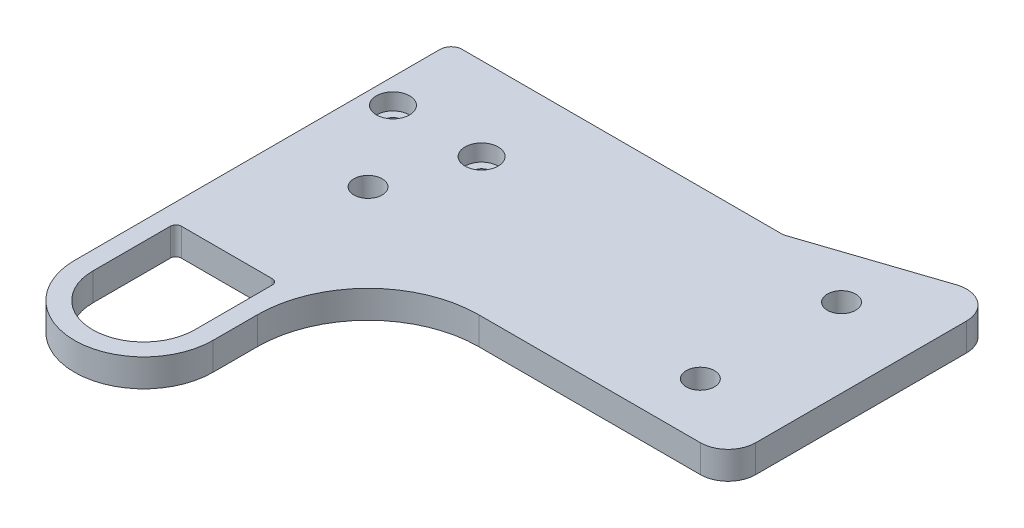
from build123d import *

# Parameters (mm, degrees)
SKETCH_1_R          = 2.55
SKETCH_1_R_2        = 7.5
EXTRUDE_1_DEPTH     = 5
FILLET_1_R          = 20
FILLET_2_R          = 5
CUT_EXTRUDE_1_DEPTH = 109.559891304
EXTRUDE_2_DEPTH     = 5
SKETCH_3_R          = 1.55
CUT_EXTRUDE_2_DEPTH = 109.559891304
FILLET_3_R          = 2
SKETCH_5_R          = 3
CUT_EXTRUDE_3_DEPTH = 3


with BuildPart() as part:
    # ｽｹｯﾁ1 → ﾎﾞｽ - 押し出し1 (new body)
    with BuildSketch(Plane(origin=(0, 0, 0), x_dir=(1, 0, 0), z_dir=(0, 1, 0))):
        with BuildLine():
            Line((0, 0), (0, -48))
            ThreePointArc((0, -48), (12.5, -60.5), (25, -48))
            Line((25, -48), (25, -20))
            Line((25, -20), (90, -20))
            Line((90, -20), (90, 30))
            Line((90, 30), (0, 0))
        make_face()
        with Locations(Location((75.769750529, 14.715657976, 0), (0, 0, 270))):
            Circle(SKETCH_1_R, mode=Mode.SUBTRACT)
        with Locations(Location((75, -10, 0), (0, 0, 270))):
            Circle(SKETCH_1_R, mode=Mode.SUBTRACT)
        with Locations(Location((15, -10, 0), (0, 0, 270))):
            Circle(SKETCH_1_R, mode=Mode.SUBTRACT)
        with Locations(Location((12.5, -48, 0), (0, 0, 270))):
            Circle(SKETCH_1_R_2, mode=Mode.SUBTRACT)
    extrude(amount=EXTRUDE_1_DEPTH)

    # ﾌｨﾚｯﾄ1
    fillet_1_edges = [part.edges().sort_by_distance(p)[0] for p in [
        (25, 2.5, 20),
    ]]
    fillet(fillet_1_edges, radius=FILLET_1_R)

    # ﾌｨﾚｯﾄ2
    fillet_2_edges = [part.edges().sort_by_distance(p)[0] for p in [
        (90, 2.5, -30),
        (90, 2.5, 20),
    ]]
    fillet(fillet_2_edges, radius=FILLET_2_R)

    # ｽｹｯﾁ2 → ｶｯﾄ - 押し出し1 (cut, through all)
    with BuildSketch(Plane(origin=(0, 5, 0), x_dir=(1, 0, 0), z_dir=(0, 1, 0))):
        with BuildLine():
            Line((3.3, -48), (3.3, -34))
            ThreePointArc((3.3, -34), (3.592893219, -33.292893219), (4.3, -33))
            Line((4.3, -33), (20.7, -33))
            ThreePointArc((20.7, -33), (21.407106781, -33.292893219), (21.7, -34))
            Line((21.7, -34), (21.7, -48))
            ThreePointArc((21.7, -48), (12.5, -57.2), (3.3, -48))
        make_face()
    extrude(amount=-CUT_EXTRUDE_1_DEPTH, mode=Mode.SUBTRACT)

    # ｽｹｯﾁ4 → ﾎﾞｽ - 押し出し2 (add)
    with BuildSketch(Plane(origin=(0, 5, 0), x_dir=(1, 0, 0), z_dir=(0, 1, 0))):
        Polygon((0, 0), (0, 20), (60, 20), align=None)
    extrude(amount=-EXTRUDE_2_DEPTH)

    # ｽｹｯﾁ3 → ｶｯﾄ - 押し出し2 (cut, through all)
    with BuildSketch(Plane(origin=(0, 5, 0), x_dir=(1, 0, 0), z_dir=(0, 1, 0))):
        with Locations(Location((20.5, 5, 0), (0, 0, 270))):
            Circle(SKETCH_3_R)
        with Locations(Location((4.5, 5, 0), (0, 0, 90))):
            Circle(SKETCH_3_R)
    extrude(amount=-CUT_EXTRUDE_2_DEPTH, mode=Mode.SUBTRACT)

    # ﾌｨﾚｯﾄ3
    fillet_3_edges = [part.edges().sort_by_distance(p)[0] for p in [
        (60, 2.5, -20),
        (0, 2.5, -20),
    ]]
    fillet(fillet_3_edges, radius=FILLET_3_R)

    # ｽｹｯﾁ5 → ｶｯﾄ - 押し出し3 (cut)
    with BuildSketch(Plane.XZ.offset(-5)):
        with Locations(Location((4.5, -5, 0), (0, 0, 270))):
            Circle(SKETCH_5_R)
        with Locations(Location((20.5, -5, 0), (0, 0, 270))):
            Circle(SKETCH_5_R)
    extrude(amount=CUT_EXTRUDE_3_DEPTH, mode=Mode.SUBTRACT)


solid = part.part
